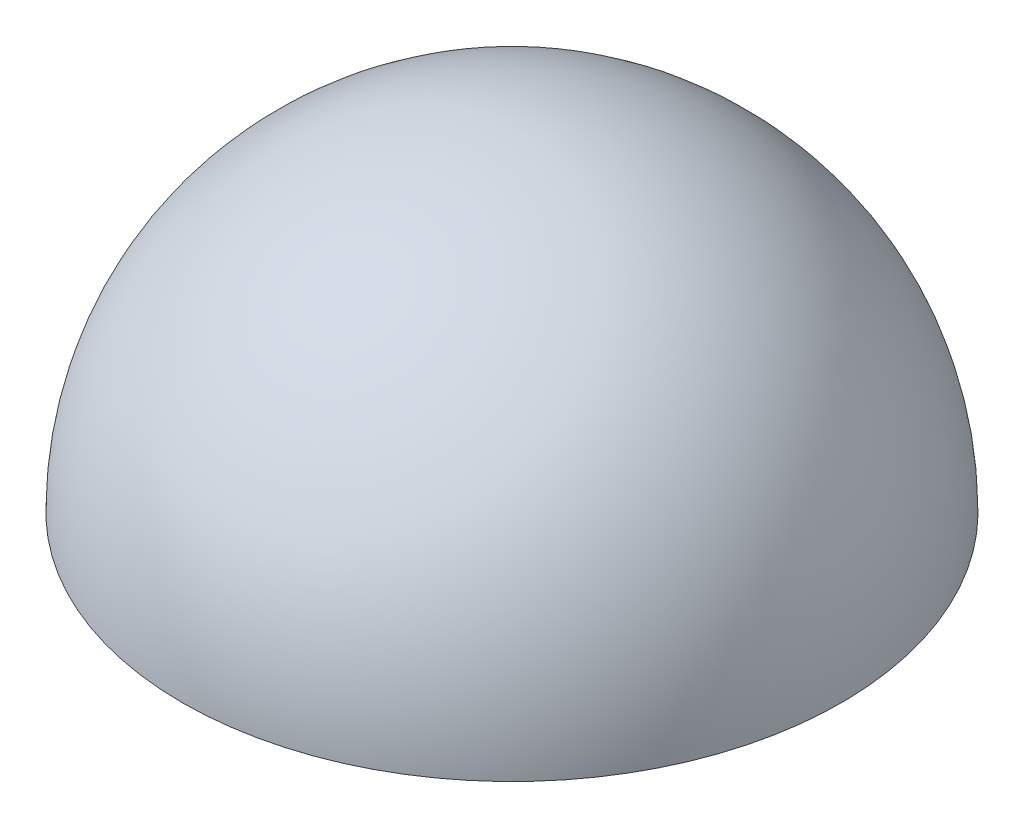
from build123d import *

# Parameters (mm, degrees)
SHELL1_T           = 2
SKETCH2_R          = 125.720178412
CUT_EXTRUDE1_DEPTH = 156
SKETCH3_R          = 99
CUT_EXTRUDE2_DEPTH = 4


with BuildPart() as part:
    # Sketch1 → Revolve1 (revolve)
    with BuildSketch(Plane(origin=(0, 0, 0), x_dir=(1, 0, 0), z_dir=(0, 1, 0))):
        with BuildLine():
            Line((0, 100), (0, -100))
            ThreePointArc((0, -100), (100, 0), (0, 100))
        make_face()
    revolve(axis=Axis((0, 0, -100), (0, 0, 1)))

    # Shell1 (no face opened: a closed hollow body)
    add(offset(amount=-SHELL1_T, mode=Mode.PRIVATE), mode=Mode.SUBTRACT)

    # Sketch2 → Cut-Extrude1 (cut)
    with BuildSketch(Plane(origin=(0, 0, 0), x_dir=(1, 0, 0), z_dir=(0, 1, 0))):
        Circle(SKETCH2_R)
    extrude(amount=-CUT_EXTRUDE1_DEPTH, mode=Mode.SUBTRACT)

    # Sketch3 → Cut-Extrude2 (cut)
    with BuildSketch(Plane(origin=(0, 0, 0), x_dir=(-1, 0, 0), z_dir=(0, -1, 0))):
        with Locations(Location((0, 0, 0), (0, 0, 90))):
            Circle(SKETCH3_R)
    extrude(amount=-CUT_EXTRUDE2_DEPTH, mode=Mode.SUBTRACT)


solid = part.part
